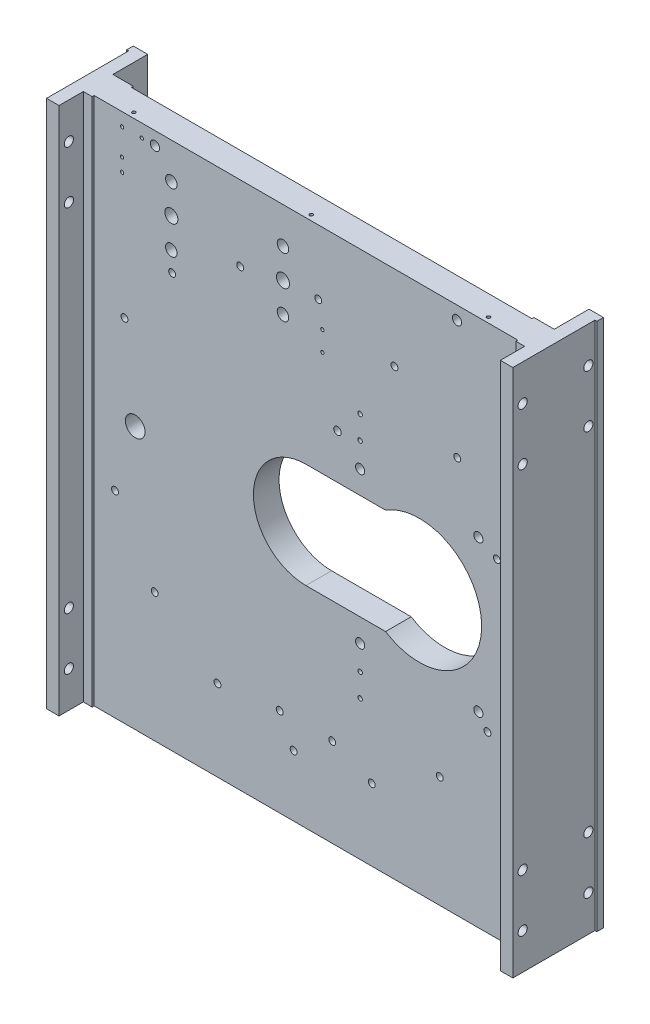
from build123d import *

# Parameters (mm, degrees)
EXTRUDE_1_DEPTH           = 805
EXTRUDE_2_DEPTH           = 805
EXTRUDE_3_DEPTH           = 805
CUT_EXTRUDE_1_DEPTH       = 892.299051946
CUT_EXTRUDE_1_DEPTH_BACK  = 892.299051946
SKETCH_4_W                = 121.26524617
SKETCH_4_H                = 160
CUT_EXTRUDE_2_DEPTH       = 892.299051946
CUT_EXTRUDE_2_DEPTH_BACK  = 892.299051946
SKETCH_5_R                = 80
CUT_EXTRUDE_3_DEPTH       = 892.299051946
CUT_EXTRUDE_3_DEPTH_BACK  = 892.299051946
SKETCH_6_R                = 95
CUT_EXTRUDE_4_DEPTH       = 892.299051946
CUT_EXTRUDE_4_DEPTH_BACK  = 892.299051946
SKETCH_7_R                = 15
CUT_EXTRUDE_5_DEPTH       = 892.299051946
CUT_EXTRUDE_5_DEPTH_BACK  = 892.299051946
SKETCH_8_R                = 5.25
CUT_EXTRUDE_6_DEPTH       = 892.299051946
CUT_EXTRUDE_6_DEPTH_BACK  = 892.299051946
SKETCH_9_R                = 8.75
CUT_EXTRUDE_7_DEPTH       = 892.299051946
CUT_EXTRUDE_7_DEPTH_BACK  = 892.299051946
SKETCH_10_R               = 10
CUT_EXTRUDE_8_DEPTH       = 892.299051946
CUT_EXTRUDE_8_DEPTH_BACK  = 892.299051946
SKETCH_11_R               = 7
CUT_EXTRUDE_9_DEPTH       = 892.299051946
CUT_EXTRUDE_9_DEPTH_BACK  = 892.299051946
SKETCH_12_R               = 3.4
CUT_EXTRUDE_10_DEPTH      = 892.299051946
CUT_EXTRUDE_10_DEPTH_BACK = 892.299051946
SKETCH_13_R               = 5.25
CUT_EXTRUDE_11_DEPTH      = 892.299051946
CUT_EXTRUDE_11_DEPTH_BACK = 892.299051946
SKETCH_14_R               = 2.5
CUT_EXTRUDE_12_DEPTH      = 892.299051946
CUT_EXTRUDE_12_DEPTH_BACK = 892.299051946
SKETCH_15_R               = 5.7225
CUT_EXTRUDE_13_DEPTH      = 892.299051946
CUT_EXTRUDE_13_DEPTH_BACK = 892.299051946
SKETCH_16_R               = 7
CUT_EXTRUDE_14_DEPTH      = 892.299051946
CUT_EXTRUDE_14_DEPTH_BACK = 892.299051946
SKETCH_17_R               = 7
SKETCH_19_R               = 2.5
CUT_EXTRUDE_16_DEPTH      = 15
SKETCH_20_R               = 2.5
CUT_EXTRUDE_17_DEPTH      = 55
CUT_EXTRUDE_START         = -15
SKETCH_21_R               = 2.5
CUT_EXTRUDE_18_DEPTH      = 15
SKETCH_23_R               = 2.5
CUT_EXTRUDE_20_DEPTH      = 15
SKETCH_25_R               = 2.5
CUT_EXTRUDE_22_DEPTH      = 68
SKETCH_27_R               = 2.1
CUT_EXTRUDE_24_DEPTH      = 71


with BuildPart() as part:
    # ｽｹｯﾁ1 → ﾎﾞｽ - 押し出し1 (new body)
    with BuildSketch(Plane(origin=(0, 0, 0), x_dir=(1, 0, 0), z_dir=(0, 1, 0))):
        Polygon((-336, 37), (-322.5, 37), (-322.5, 40), (322.5, 40), (322.5, 37), (336, 37), (336, 82), (305, 82), (305, 79), (-305, 79), (-305, 82), (-336, 82), align=None)
    extrude(amount=EXTRUDE_1_DEPTH)

    # ｽｹｯﾁ2 → ﾎﾞｽ - 押し出し2 (add)
    with BuildSketch(Plane(origin=(0, 0, 0), x_dir=(1, 0, 0), z_dir=(0, 1, 0))):
        Polygon((-355, 0), (-336, 0), (-336, 135), (-358, 135), (-358, 125), (-355, 125), align=None)
    extrude(amount=EXTRUDE_2_DEPTH)

    # ｽｹｯﾁ3 → ﾎﾞｽ - 押し出し3 (add)
    with BuildSketch(Plane(origin=(0, 0, 0), x_dir=(1, 0, 0), z_dir=(0, 1, 0))):
        Polygon((355, 0), (336, 0), (336, 135), (358, 135), (358, 125), (355, 125), align=None)
    extrude(amount=EXTRUDE_3_DEPTH)

    # ｽｹｯﾁ4 → ｶｯﾄ - 押し出し1 (cut, two sides: drawn at the far end of the back side and taken through both)
    with BuildSketch(Plane.XY.offset(-CUT_EXTRUDE_1_DEPTH_BACK)):
        with Locations((60.632623085, 400)):
            Rectangle(SKETCH_4_W, SKETCH_4_H)
    extrude(amount=CUT_EXTRUDE_1_DEPTH + CUT_EXTRUDE_1_DEPTH_BACK, mode=Mode.SUBTRACT)

    # ｽｹｯﾁ5 → ｶｯﾄ - 押し出し2 (cut, two sides: drawn at the far end of the back side and taken through both)
    with BuildSketch(Plane.XY.offset(-CUT_EXTRUDE_2_DEPTH_BACK)):
        with Locations((0, 400)):
            Circle(SKETCH_5_R)
    extrude(amount=CUT_EXTRUDE_2_DEPTH + CUT_EXTRUDE_2_DEPTH_BACK, mode=Mode.SUBTRACT)

    # ｽｹｯﾁ6 → ｶｯﾄ - 押し出し3 (cut, two sides: drawn at the far end of the back side and taken through both)
    with BuildSketch(Plane.XY.offset(-CUT_EXTRUDE_3_DEPTH_BACK)):
        with Locations((172.5, 400)):
            Circle(SKETCH_6_R)
    extrude(amount=CUT_EXTRUDE_3_DEPTH + CUT_EXTRUDE_3_DEPTH_BACK, mode=Mode.SUBTRACT)

    # ｽｹｯﾁ7 → ｶｯﾄ - 押し出し4 (cut, two sides: drawn at the far end of the back side and taken through both)
    with BuildSketch(Plane.XY.offset(-CUT_EXTRUDE_4_DEPTH_BACK)):
        with Locations((-260, 400)):
            Circle(SKETCH_7_R)
    extrude(amount=CUT_EXTRUDE_4_DEPTH + CUT_EXTRUDE_4_DEPTH_BACK, mode=Mode.SUBTRACT)

    # ｽｹｯﾁ8 → ｶｯﾄ - 押し出し5 (cut, two sides: drawn at the far end of the back side and taken through both)
    with BuildSketch(Plane.XY.offset(-CUT_EXTRUDE_5_DEPTH_BACK)):
        with Locations((290.746961997, 500.112207496)):
            Circle(SKETCH_8_R)
        with Locations((230.303884143, 603.755664826)):
            Circle(SKETCH_8_R)
        with Locations((134.799127638, 676.379169237)):
            Circle(SKETCH_8_R)
        with Locations((18.772425907, 706.926450515)):
            Circle(SKETCH_8_R)
        with Locations((-100.112207496, 690.746961997)):
            Circle(SKETCH_8_R)
        with Locations((-203.755664826, 630.303884143)):
            Circle(SKETCH_8_R)
        with Locations((-276.379169237, 534.799127638)):
            Circle(SKETCH_8_R)
        with Locations((-290.746961997, 299.887792504)):
            Circle(SKETCH_8_R)
        with Locations((-230.303884143, 196.244335174)):
            Circle(SKETCH_8_R)
        with Locations((-134.799127638, 123.620830763)):
            Circle(SKETCH_8_R)
        with Locations((-18.772425907, 93.073549485)):
            Circle(SKETCH_8_R)
        with Locations((100.112207496, 109.253038003)):
            Circle(SKETCH_8_R)
        with Locations((203.755664826, 169.696115857)):
            Circle(SKETCH_8_R)
        with Locations((276.379169237, 265.200872362)):
            Circle(SKETCH_8_R)
    extrude(amount=CUT_EXTRUDE_5_DEPTH + CUT_EXTRUDE_5_DEPTH_BACK, mode=Mode.SUBTRACT)

    # ｽｹｯﾁ9 → ｶｯﾄ - 押し出し6 (cut, two sides: drawn at the far end of the back side and taken through both)
    with BuildSketch(Plane.XY.offset(-CUT_EXTRUDE_6_DEPTH_BACK)):
        with Locations((-205, 660)):
            Circle(SKETCH_9_R)
        with Locations((-205, 750)):
            Circle(SKETCH_9_R)
        with Locations((-35, 660)):
            Circle(SKETCH_9_R)
        with Locations((-35, 750)):
            Circle(SKETCH_9_R)
    extrude(amount=CUT_EXTRUDE_6_DEPTH + CUT_EXTRUDE_6_DEPTH_BACK, mode=Mode.SUBTRACT)

    # ｽｹｯﾁ10 → ｶｯﾄ - 押し出し7 (cut, two sides: drawn at the far end of the back side and taken through both)
    with BuildSketch(Plane.XY.offset(-CUT_EXTRUDE_7_DEPTH_BACK)):
        with Locations((-205, 705)):
            Circle(SKETCH_10_R)
        with Locations((-35, 705)):
            Circle(SKETCH_10_R)
    extrude(amount=CUT_EXTRUDE_7_DEPTH + CUT_EXTRUDE_7_DEPTH_BACK, mode=Mode.SUBTRACT)

    # ｽｹｯﾁ11 → ｶｯﾄ - 押し出し8 (cut, two sides: drawn at the far end of the back side and taken through both)
    with BuildSketch(Plane.XY.offset(-CUT_EXTRUDE_8_DEPTH_BACK)):
        with Locations((82.5, 285)):
            Circle(SKETCH_11_R)
        with Locations((262.5, 285)):
            Circle(SKETCH_11_R)
        with Locations((82.5, 515)):
            Circle(SKETCH_11_R)
        with Locations((262.5, 515)):
            Circle(SKETCH_11_R)
    extrude(amount=CUT_EXTRUDE_8_DEPTH + CUT_EXTRUDE_8_DEPTH_BACK, mode=Mode.SUBTRACT)

    # ｽｹｯﾁ12 → ｶｯﾄ - 押し出し9 (cut, two sides: drawn at the far end of the back side and taken through both)
    with BuildSketch(Plane.XY.offset(-CUT_EXTRUDE_9_DEPTH_BACK)):
        with Locations((82.5, 212.5)):
            Circle(SKETCH_12_R)
        with Locations((82.5, 247.5)):
            Circle(SKETCH_12_R)
        with Locations((82.5, 552.5)):
            Circle(SKETCH_12_R)
        with Locations((82.5, 587.5)):
            Circle(SKETCH_12_R)
    extrude(amount=CUT_EXTRUDE_9_DEPTH + CUT_EXTRUDE_9_DEPTH_BACK, mode=Mode.SUBTRACT)

    # ｽｹｯﾁ13 → ｶｯﾄ - 押し出し10 (cut, two sides: drawn at the far end of the back side and taken through both)
    with BuildSketch(Plane.XY.offset(-CUT_EXTRUDE_10_DEPTH_BACK)):
        with Locations((-40, 135)):
            Circle(SKETCH_13_R)
        with Locations((40, 135)):
            Circle(SKETCH_13_R)
    extrude(amount=CUT_EXTRUDE_10_DEPTH + CUT_EXTRUDE_10_DEPTH_BACK, mode=Mode.SUBTRACT)

    # ｽｹｯﾁ14 → ｶｯﾄ - 押し出し11 (cut, two sides: drawn at the far end of the back side and taken through both)
    with BuildSketch(Plane.XY.offset(-CUT_EXTRUDE_11_DEPTH_BACK)):
        with Locations((25, 640)):
            Circle(SKETCH_14_R)
        with Locations((25, 670)):
            Circle(SKETCH_14_R)
    extrude(amount=CUT_EXTRUDE_11_DEPTH + CUT_EXTRUDE_11_DEPTH_BACK, mode=Mode.SUBTRACT)

    # ｽｹｯﾁ15 → ｶｯﾄ - 押し出し12 (cut, two sides: drawn at the far end of the back side and taken through both)
    with BuildSketch(Plane.XY.offset(-CUT_EXTRUDE_12_DEPTH_BACK)):
        with Locations((48, 548)):
            Circle(SKETCH_15_R)
    extrude(amount=CUT_EXTRUDE_12_DEPTH + CUT_EXTRUDE_12_DEPTH_BACK, mode=Mode.SUBTRACT)

    # ｽｹｯﾁ16 → ｶｯﾄ - 押し出し13 (cut, two sides: drawn at the far end of the back side and taken through both)
    with BuildSketch(Plane.XY.offset(-CUT_EXTRUDE_13_DEPTH_BACK)):
        with Locations((-230, 785)):
            Circle(SKETCH_16_R)
        with Locations((230, 785)):
            Circle(SKETCH_16_R)
    extrude(amount=CUT_EXTRUDE_13_DEPTH + CUT_EXTRUDE_13_DEPTH_BACK, mode=Mode.SUBTRACT)

    # ｽｹｯﾁ17 → ｶｯﾄ - 押し出し14 (cut, two sides: drawn at the far end of the back side and taken through both)
    with BuildSketch(Plane(origin=(0, 0, 0), x_dir=(0, 0, -1), z_dir=(1, 0, 0)).offset(-CUT_EXTRUDE_14_DEPTH_BACK)):
        with Locations((15, 55)):
            Circle(SKETCH_17_R)
        with Locations((15, 135)):
            Circle(SKETCH_17_R)
        with Locations((15, 670)):
            Circle(SKETCH_17_R)
        with Locations((15, 750)):
            Circle(SKETCH_17_R)
        with Locations((115, 55)):
            Circle(SKETCH_17_R)
        with Locations((115, 135)):
            Circle(SKETCH_17_R)
        with Locations((115, 670)):
            Circle(SKETCH_17_R)
        with Locations((115, 750)):
            Circle(SKETCH_17_R)
    extrude(amount=CUT_EXTRUDE_14_DEPTH + CUT_EXTRUDE_14_DEPTH_BACK, mode=Mode.SUBTRACT)

    # ｽｹｯﾁ19 → ｶｯﾄ - 押し出し16 (cut)
    with BuildSketch(Plane(origin=(0, 0, 0), x_dir=(1, 0, 0), z_dir=(0, 1, 0))):
        with Locations(Location((-270, 48, 0), (0, 0, 270))):
            Circle(SKETCH_19_R)
        with Locations(Location((0, 48, 0), (0, 0, 270))):
            Circle(SKETCH_19_R)
        with Locations(Location((270, 48, 0), (0, 0, 270))):
            Circle(SKETCH_19_R)
    extrude(amount=CUT_EXTRUDE_16_DEPTH, mode=Mode.SUBTRACT)

    # ｽｹｯﾁ20 → ｶｯﾄ - 押し出し17 (cut)
    with BuildSketch(Plane.XY):
        with Locations((-280, 725)):
            Circle(SKETCH_20_R)
        with Locations((-280, 745)):
            Circle(SKETCH_20_R)
        with Locations((-280, 785)):
            Circle(SKETCH_20_R)
        with Locations((-250, 785)):
            Circle(SKETCH_20_R)
    extrude(amount=-CUT_EXTRUDE_17_DEPTH, mode=Mode.SUBTRACT)

    # ｽｹｯﾁ21 → ｶｯﾄ - 押し出し18 (cut)
    with BuildSketch(Plane(origin=(0, 805, 0), x_dir=(1, 0, 0), z_dir=(0, 1, 0)).offset(CUT_EXTRUDE_START)):
        with Locations(Location((-270, 48, 0), (0, 0, 270))):
            Circle(SKETCH_21_R)
        with Locations(Location((0, 48, 0), (0, 0, 270))):
            Circle(SKETCH_21_R)
        with Locations(Location((270, 48, 0), (0, 0, 270))):
            Circle(SKETCH_21_R)
    extrude(amount=CUT_EXTRUDE_18_DEPTH, mode=Mode.SUBTRACT)

    # ｽｹｯﾁ23 → ｶｯﾄ - 押し出し20 (cut)
    with BuildSketch(Plane.XY.offset(-135)):
        with Locations((-348, 38)):
            Circle(SKETCH_23_R)
        with Locations((-348, 158)):
            Circle(SKETCH_23_R)
    extrude(amount=CUT_EXTRUDE_20_DEPTH, mode=Mode.SUBTRACT)

    # ｽｹｯﾁ25 → ｶｯﾄ - 押し出し22 (cut)
    with BuildSketch(Plane.XY.offset(-135)):
        with Locations((-260, 370)):
            Circle(SKETCH_25_R)
        with Locations((-260, 430)):
            Circle(SKETCH_25_R)
    extrude(amount=CUT_EXTRUDE_22_DEPTH, mode=Mode.SUBTRACT)

    # ｽｹｯﾁ27 → ｶｯﾄ - 押し出し24 (cut)
    with BuildSketch(Plane.XY.offset(-135)):
        with Locations((135, 640)):
            Circle(SKETCH_27_R)
        with Locations((250, 640)):
            Circle(SKETCH_27_R)
    extrude(amount=CUT_EXTRUDE_24_DEPTH, mode=Mode.SUBTRACT)


solid = part.part
